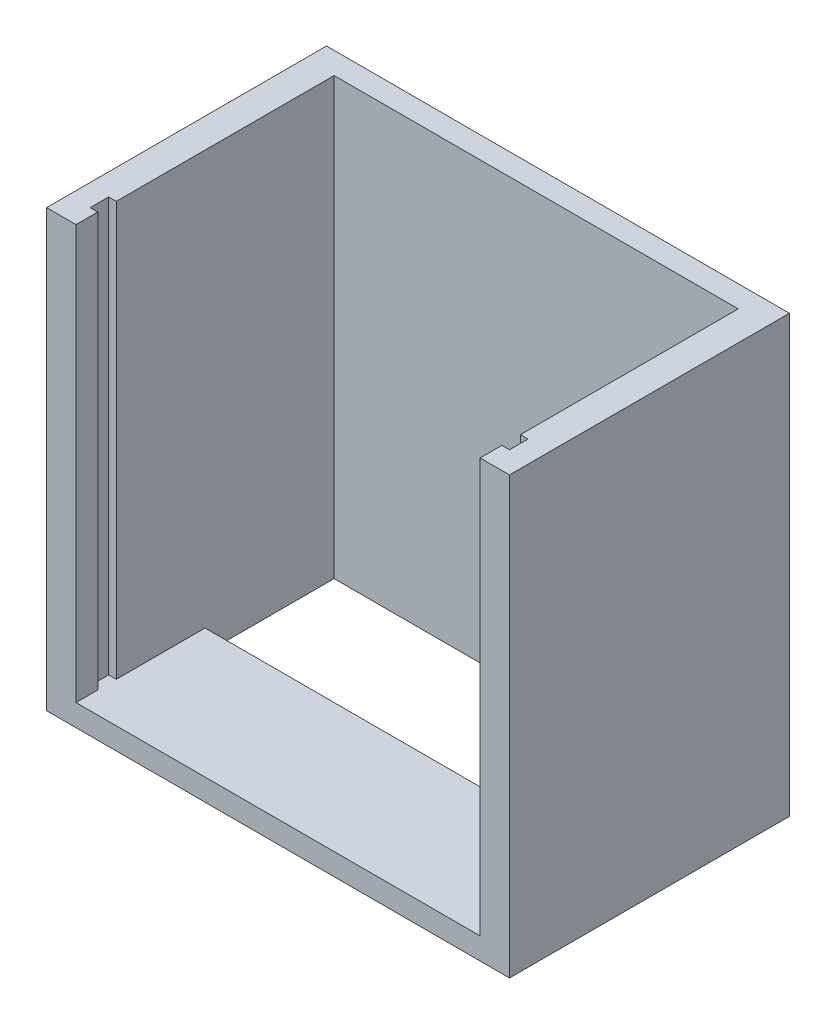
from build123d import *

# Parameters (mm, degrees)
BOSS_EXTRUDE1_DEPTH   = 38
BOSS_EXTRUDE1_2_DEPTH = 38
SKETCH2_W             = 42.5
SKETCH2_H             = 5.7
BOSS_EXTRUDE2_DEPTH   = 2
BOSS_EXTRUDE3_DEPTH   = 18
SKETCH4_W             = 42.5
SKETCH4_H             = 40
BOSS_EXTRUDE4_DEPTH   = 2
SKETCH5_W             = 37.1
SKETCH5_H             = 11.85
CUT_EXTRUDE1_DEPTH    = 81.281509747


with BuildPart() as part:
    # Sketch1 → Boss-Extrude1 (new body)
    with BuildSketch(Plane(origin=(0, 0, 0), x_dir=(1, 0, 0), z_dir=(0, 1, 0))):
        Polygon((-62.898983402, -26.09346473), (-62.898983402, -24.39346473), (-62.198983402, -24.39346473), (-62.198983402, -22.39346473), (-64.898983402, -22.39346473), (-64.898983402, -28.09346473), (-62.198983402, -28.09346473), (-62.198983402, -26.09346473), align=None)
    extrude(amount=BOSS_EXTRUDE1_DEPTH)



with BuildPart() as body_2:
    # Sketch1 → Boss-Extrude1 2 (new body)
    with BuildSketch(Plane(origin=(0, 0, 0), x_dir=(1, 0, 0), z_dir=(0, 1, 0))):
        Polygon((-25.098983402, -22.39346473), (-25.098983402, -24.39346473), (-24.398983402, -24.39346473), (-24.398983402, -26.09346473), (-25.098983402, -26.09346473), (-25.098983402, -28.09346473), (-22.398983402, -28.09346473), (-22.398983402, -22.39346473), align=None)
    extrude(amount=BOSS_EXTRUDE1_2_DEPTH)


with BuildPart() as part_1:
    add(part.part)

    add(body_2.part)  # Boss-Extrude2 merges body 2
    # Sketch2 → Boss-Extrude2 (add)
    with BuildSketch(Plane(origin=(0, 0, 0), x_dir=(1, 0, 0), z_dir=(0, 1, 0))):
        with Locations((-43.648983402, -25.24346473)):
            Rectangle(SKETCH2_W, SKETCH2_H)
    extrude(amount=-BOSS_EXTRUDE2_DEPTH)

    # Sketch3 → Boss-Extrude3 (add)
    with BuildSketch(Plane(origin=(0, 0, 22.39346473), x_dir=(-1, 0, 0), z_dir=(0, 0, -1))):
        Polygon((64.898983402, 38), (62.198983402, 38), (62.198983402, 0), (25.098983402, 0), (25.098983402, 38), (22.398983402, 38), (22.398983402, -2), (64.898983402, -2), align=None)
    extrude(amount=BOSS_EXTRUDE3_DEPTH)

    # Sketch4 → Boss-Extrude4 (add)
    with BuildSketch(Plane(origin=(0, 0, 4.39346473), x_dir=(-1, 0, 0), z_dir=(0, 0, -1))):
        with Locations((43.648983402, 18)):
            Rectangle(SKETCH4_W, SKETCH4_H)
    extrude(amount=BOSS_EXTRUDE4_DEPTH)

    # Sketch5 → Cut-Extrude1 (cut, through all)
    with BuildSketch(Plane(origin=(0, 0, 0), x_dir=(1, 0, 0), z_dir=(0, 1, 0))):
        with Locations((-43.648983402, -10.31846473)):
            Rectangle(SKETCH5_W, SKETCH5_H)
    extrude(amount=-CUT_EXTRUDE1_DEPTH, mode=Mode.SUBTRACT)


solid = part_1.part
